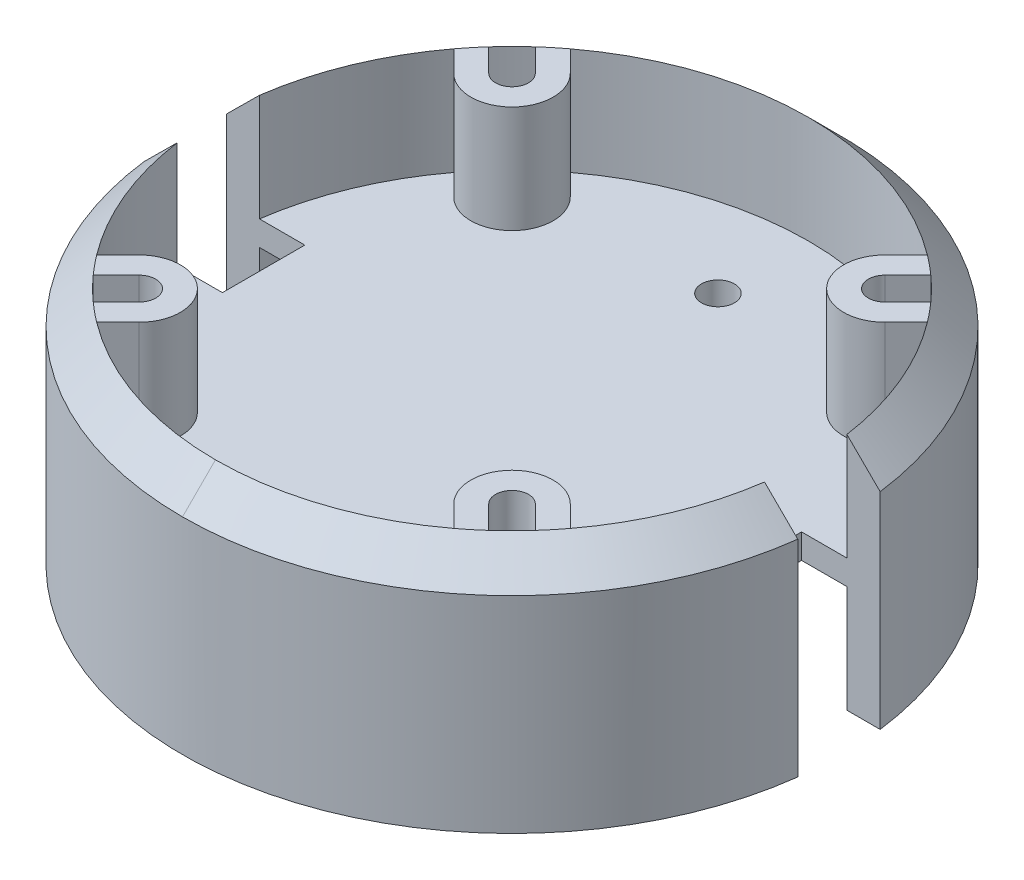
from build123d import *
from build123d.topology import SkipClean

# Parameters (mm, degrees)
SKETCH_1_R               = 18
EXTRUDE_1_DEPTH          = 1.5
EXTRUDE_2_DEPTH          = 6
EXTRUDE_2_DEPTH_BACK     = 6.5
SKETCH_2_R               = 20
SKETCH_2_R_2             = 18
CUT_EXTRUDE_START        = 1.5
SKETCH_6_R               = 1
CUT_EXTRUDE_4_DEPTH      = 8
CUT_EXTRUDE_5_DEPTH      = 30.393876913
CUT_EXTRUDE_5_DEPTH_BACK = 30.393876913
CUT_EXTRUDE_6_DEPTH      = 1.5
EXTRUDE_START            = 8
EXTRUDE_3_DEPTH          = 6.5


with BuildPart() as part:
    # 草图1 → 凸台-拉伸1 (new body)
    with BuildSketch(Plane(origin=(0, 0, 0), x_dir=(1, 0, 0), z_dir=(0, 1, 0))):
        with Locations(Location((0, 0, 0), (0, 0, 270))):
            Circle(SKETCH_1_R)
    extrude(amount=EXTRUDE_1_DEPTH)

    # 草图2 → 凸台-拉伸2 (add, two sides: drawn at the far end of the back side and taken through both)
    with BuildSketch(Plane(origin=(0, 0, 0), x_dir=(1, 0, 0), z_dir=(0, 1, 0)).offset(-EXTRUDE_2_DEPTH_BACK)):
        with Locations(Location((0, 0, 0), (0, 0, 270))):
            Circle(SKETCH_2_R)
        with Locations(Location((0, 0, 0), (0, 0, 270))):
            Circle(SKETCH_2_R_2, mode=Mode.SUBTRACT)
    extrude(amount=EXTRUDE_2_DEPTH + EXTRUDE_2_DEPTH_BACK)

    # 扫描2: sweep along a curve in space
    with SkipClean():  # the faces are left unmerged after this step: merging them gives an invalid solid
        with BuildLine() as sweep_2_path:
            ThreePointArc((0, 6, 18), (12.727922061, 6, 12.727922061), (18, 6, 0))
            ThreePointArc((18, 6, 0), (12.727922061, 6, -12.727922061), (0, 6, -18))
            ThreePointArc((0, 6, -18), (-12.727922061, 6, -12.727922061), (-18, 6, 0))
            ThreePointArc((-18, 6, 0), (-12.727922061, 6, 12.727922061), (0, 6, 18))
        # 草图5 → 扫描2 (sweep)
        with BuildSketch(Plane.XY):
            Polygon((-20, 6), (-18, 6), (-18, 8), align=None)
        sweep(path=sweep_2_path.line)

    # 草图6 → 切除-拉伸4 (cut)
    with SkipClean():  # the faces are left unmerged after this step: merging them gives an invalid solid
        with BuildSketch(Plane(origin=(0, 0, 0), x_dir=(1, 0, 0), z_dir=(0, 1, 0)).offset(CUT_EXTRUDE_START)):
            with Locations(Location((0, -12.5, 0), (0, 0, 270))):
                Circle(SKETCH_6_R)
            with Locations(Location((0, 12.5, 0), (0, 0, 270))):
                Circle(SKETCH_6_R)
        extrude(amount=-CUT_EXTRUDE_4_DEPTH, mode=Mode.SUBTRACT)

    # 草图7 → 切除-拉伸5 (cut, two sides: drawn at the far end of the back side and taken through both)
    with BuildSketch(Plane(origin=(0, 0, 0), x_dir=(1, 0, 0), z_dir=(0, 1, 0)).offset(-CUT_EXTRUDE_5_DEPTH_BACK)):
        with BuildLine():
            Line((-19.843134833, -2.5), (-15.07554347, -2.5))
            Line((-15.07554347, -2.5), (-15.07554347, 2.5))
            Line((-15.07554347, 2.5), (-19.843134833, 2.5))
            ThreePointArc((-19.843134833, 2.5), (-20, 0), (-19.843134833, -2.5))
        make_face()
        with BuildLine():
            Line((15.07554347, 2.5), (15.07554347, -2.5))
            Line((15.07554347, -2.5), (19.843134833, -2.5))
            ThreePointArc((19.843134833, -2.5), (20, 0), (19.843134833, 2.5))
            Line((19.843134833, 2.5), (15.07554347, 2.5))
        make_face()
    extrude(amount=CUT_EXTRUDE_5_DEPTH + CUT_EXTRUDE_5_DEPTH_BACK, mode=Mode.SUBTRACT)

    # 草图8 → 切除-拉伸6 (cut)
    with SkipClean():  # the faces are left unmerged after this step: merging them gives an invalid solid
        with BuildSketch(Plane(origin=(0, 0, 0), x_dir=(1, 0, 0), z_dir=(0, 1, 0)).offset(CUT_EXTRUDE_START)):
            with BuildLine():
                Line((10.606601706, 12.020815293), (12.001158233, 13.41537182))
                ThreePointArc((12.001158233, 13.41537182), (12.727922049, 12.727922074), (13.415371797, 12.001158259))
                Line((13.415371797, 12.001158259), (12.020815268, 10.606601731))
                ThreePointArc((12.020815268, 10.606601731), (10.606601706, 10.606601706), (10.606601706, 12.020815293))
            make_face()
            with BuildLine():
                Line((12.020815268, -10.606601731), (13.415371797, -12.001158259))
                ThreePointArc((13.415371797, -12.001158259), (12.727922049, -12.727922074), (12.001158233, -13.41537182))
                Line((12.001158233, -13.41537182), (10.606601706, -12.020815293))
                ThreePointArc((10.606601706, -12.020815293), (10.606601706, -10.606601706), (12.020815268, -10.606601731))
            make_face()
            with BuildLine():
                Line((-10.606601706, -12.020815293), (-12.001158233, -13.41537182))
                ThreePointArc((-12.001158233, -13.41537182), (-12.727922049, -12.727922074), (-13.415371797, -12.001158259))
                Line((-13.415371797, -12.001158259), (-12.020815268, -10.606601731))
                ThreePointArc((-12.020815268, -10.606601731), (-10.606601706, -10.606601706), (-10.606601706, -12.020815293))
            make_face()
            with BuildLine():
                Line((-12.020815268, 10.606601731), (-13.415371797, 12.001158259))
                ThreePointArc((-13.415371797, 12.001158259), (-12.727922049, 12.727922074), (-12.001158233, 13.41537182))
                Line((-12.001158233, 13.41537182), (-10.606601706, 12.020815293))
                ThreePointArc((-10.606601706, 12.020815293), (-10.606601706, 10.606601706), (-12.020815268, 10.606601731))
            make_face()
        extrude(amount=-CUT_EXTRUDE_6_DEPTH, mode=Mode.SUBTRACT)

    # 草图9 → 凸台-拉伸3 (add)
    with SkipClean():  # the faces are left unmerged after this step: merging them gives an invalid solid
        with BuildSketch(Plane(origin=(0, 0, 0), x_dir=(1, 0, 0), z_dir=(0, 1, 0)).offset(EXTRUDE_START)):
            with BuildLine():
                Line((12.020815268, -10.606601731), (13.415371797, -12.001158259))
                ThreePointArc((13.415371797, -12.001158259), (13.906042657, -11.428997228), (14.372329608, -10.836795727))
                Line((14.372329608, -10.836795727), (13.081475446, -9.545941553))
                ThreePointArc((13.081475446, -9.545941553), (9.545941558, -9.545941548), (9.545941537, -13.081475443))
                Line((9.545941537, -13.081475443), (10.8367957, -14.372329629))
                ThreePointArc((10.8367957, -14.372329629), (11.428997201, -13.906042679), (12.001158233, -13.41537182))
                Line((12.001158233, -13.41537182), (10.606601718, -12.020815281))
                ThreePointArc((10.606601718, -12.020815281), (10.606601731, -10.606601731), (12.020815268, -10.606601731))
            make_face()
            with BuildLine():
                Line((-10.606601718, -12.020815281), (-12.001158233, -13.41537182))
                ThreePointArc((-12.001158233, -13.41537182), (-11.428997201, -13.906042679), (-10.8367957, -14.372329629))
                Line((-10.8367957, -14.372329629), (-9.545941547, -13.081475453))
                ThreePointArc((-9.545941547, -13.081475453), (-9.545941551, -9.545941542), (-13.081475462, -9.545941556))
                Line((-13.081475462, -9.545941556), (-14.372329609, -10.836795726))
                ThreePointArc((-14.372329609, -10.836795726), (-13.906042657, -11.428997227), (-13.415371797, -12.001158259))
                Line((-13.415371797, -12.001158259), (-12.020815281, -10.606601718))
                ThreePointArc((-12.020815281, -10.606601718), (-10.606601718, -10.606601718), (-10.606601718, -12.020815281))
            make_face()
            with BuildLine():
                Line((10.606601718, 12.020815281), (12.001158233, 13.41537182))
                ThreePointArc((12.001158233, 13.41537182), (11.428997201, 13.906042679), (10.8367957, 14.372329629))
                Line((10.8367957, 14.372329629), (9.545941547, 13.081475453))
                ThreePointArc((9.545941547, 13.081475453), (9.545941551, 9.545941542), (13.081475462, 9.545941556))
                Line((13.081475462, 9.545941556), (14.372329609, 10.836795726))
                ThreePointArc((14.372329609, 10.836795726), (13.906042657, 11.428997227), (13.415371797, 12.001158259))
                Line((13.415371797, 12.001158259), (12.020815281, 10.606601718))
                ThreePointArc((12.020815281, 10.606601718), (10.606601718, 10.606601718), (10.606601718, 12.020815281))
            make_face()
            with BuildLine():
                Line((-12.020815268, 10.606601731), (-13.415371797, 12.001158259))
                ThreePointArc((-13.415371797, 12.001158259), (-13.906042657, 11.428997228), (-14.372329608, 10.836795727))
                Line((-14.372329608, 10.836795727), (-13.081475446, 9.545941553))
                ThreePointArc((-13.081475446, 9.545941553), (-9.545941558, 9.545941548), (-9.545941537, 13.081475443))
                Line((-9.545941537, 13.081475443), (-10.8367957, 14.372329629))
                ThreePointArc((-10.8367957, 14.372329629), (-11.428997201, 13.906042679), (-12.001158233, 13.41537182))
                Line((-12.001158233, 13.41537182), (-10.606601718, 12.020815281))
                ThreePointArc((-10.606601718, 12.020815281), (-10.606601731, 10.606601731), (-12.020815268, 10.606601731))
            make_face()
        extrude(amount=-EXTRUDE_3_DEPTH)


solid = part.part
